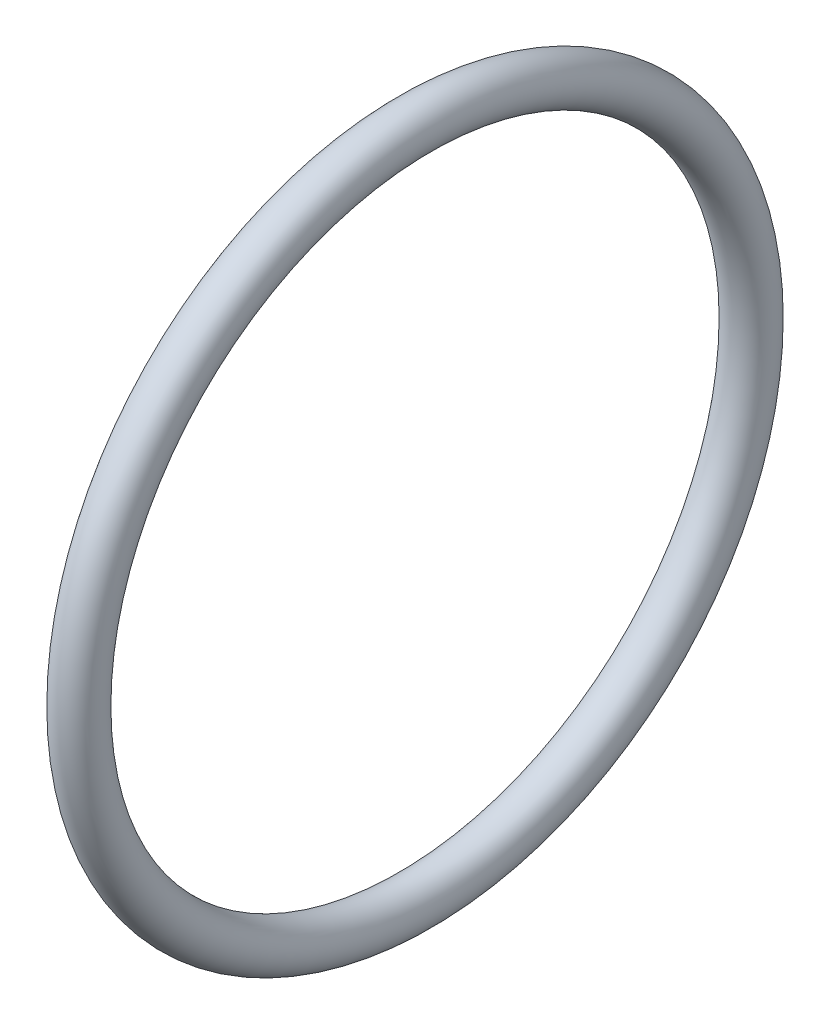
from build123d import *

# Parameters (mm, degrees)
SKETCH1_R = 1.3081


with BuildPart() as part:
    # Sketch1 → Revolve1 (revolve)
    with BuildSketch(Plane.XY, mode=Mode.PRIVATE) as revolve1_sk:
        with Locations((0, 19.3929)):
            Circle(SKETCH1_R)
    revolve(revolve1_sk.sketch.rotate(Axis((0, 0, 0), (-1, 0, 0)), 90), axis=Axis((0, 0, 0), (-1, 0, 0)))


solid = part.part
